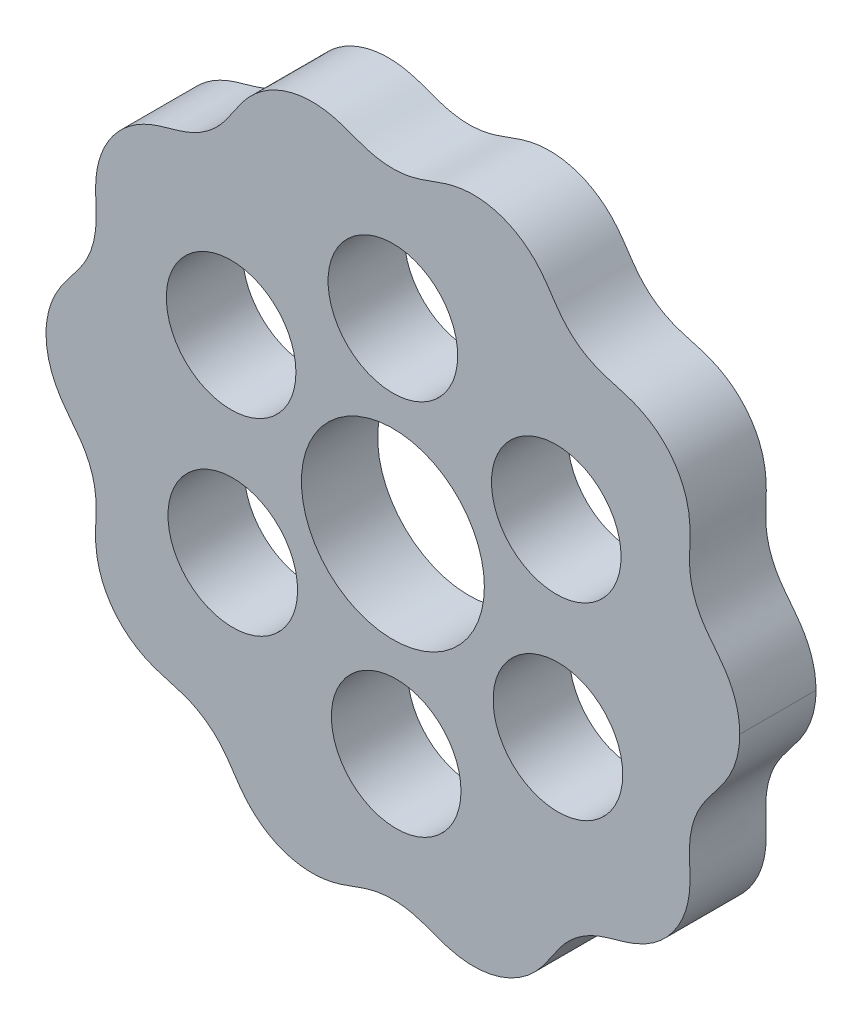
from build123d import *

# Parameters (mm, degrees)
BOSS_EXTRUDE1_DEPTH = 10
SKETCH2_R           = 12
SKETCH2_R_2         = 8.5
CUT_EXTRUDE2_DEPTH  = 10


with BuildPart() as part:
    # Sketch1 → Boss-Extrude1 (new body)
    with BuildSketch(Plane.XY):
        with BuildLine():
            add(Edge.make_bspline(
                [(-45.499991694, 0), (-45.499417721, 0.54652661), (-45.418630588, 1.636900829), (-45.062396728, 3.235524804), (-44.477595123, 4.770382806), (-43.802635021, 5.993801031), (-43.117584752, 6.994885069), (-42.499623664, 7.809687397), (-41.82997492, 8.642468091), (-41.110172207, 9.602905255), (-40.462520937, 10.575733976), (-39.757599748, 11.925585369), (-39.21583214, 13.555526257), (-38.972579651, 15.082244143), (-38.916270686, 16.281048526), (-38.927492874, 17.199543984), (-38.963794875, 18.175392663), (-39.003260031, 19.122059111), (-39.004031898, 20.081613072), (-38.955556207, 20.962340021), (-38.854082596, 21.801225418), (-38.645832299, 22.886789494), (-38.246727363, 24.191924223), (-37.547916858, 25.670868524), (-36.642286396, 27.033568382), (-35.549489209, 28.250867407), (-34.291990165, 29.297421962), (-33.12413689, 30.013667887), (-32.109992276, 30.49708058), (-31.297990382, 30.820605491), (-30.400687176, 31.118187135), (-29.3423349, 31.423004054), (-28.152021465, 31.747743147), (-26.759358853, 32.240343704), (-25.442641388, 32.853114744), (-24.023611732, 33.797227333), (-22.850981946, 34.90139513), (-22.045123753, 35.873232183), (-21.291150407, 36.920120743), (-20.680195351, 37.856732434), (-20.088480395, 38.718766678), (-19.531895352, 39.454370141), (-18.969636206, 40.109962603), (-18.383313671, 40.707421925), (-17.559784405, 41.436499391), (-16.447365301, 42.225420988), (-14.990552327, 42.969192488), (-13.440937058, 43.494661463), (-11.832306004, 43.790586252), (-10.196608172, 43.850838017), (-8.830558811, 43.704594158), (-7.718482479, 43.467180552), (-6.856019595, 43.224658939), (-5.915563706, 42.906355358), (-4.971111409, 42.550599633), (-3.942572046, 42.185362917), (-2.936548867, 41.874608525), (-1.591797743, 41.578785718), (0.084435721, 41.45309614), (1.737144316, 41.612285896), (3.031089125, 41.916499054), (4.006617187, 42.226326403), (4.999822604, 42.583557047), (5.935359682, 42.935639327), (6.864442923, 43.248322873), (7.725966983, 43.488123505), (8.834976574, 43.72134679), (10.201868138, 43.863159919), (11.836743584, 43.797264283), (13.444496644, 43.495872577), (14.992304531, 42.965093559), (16.446557836, 42.216346112), (17.556354774, 41.423607634), (18.378051445, 40.691263199), (18.963169579, 40.091199195), (19.525051949, 39.43217282), (20.083134983, 38.690896479), (20.680317711, 37.818928574), (21.305447581, 36.862747147), (22.091672553, 35.786924264), (22.937676069, 34.793085604), (24.154692188, 33.692110976), (25.584855424, 32.78536337), (26.868578459, 32.212851771), (28.220040833, 31.748210157), (29.383074268, 31.433257106), (30.426417711, 31.131917254), (31.317702477, 30.834269586), (32.126551087, 30.509259886), (33.13742679, 30.023499614), (34.302481893, 29.303589201), (35.556330934, 28.252795818), (36.644980393, 27.031780142), (37.545944658, 25.665902571), (38.239684637, 24.18498897), (38.713477442, 22.615295054), (38.92299222, 21.244126843), (38.984539855, 20.066104892), (38.981929249, 19.099312235), (38.941333185, 18.138789763), (38.906917281, 17.138757979), (38.90117585, 16.191197892), (38.9735828, 14.952525555), (39.25208527, 13.393388424), (39.829735801, 11.778030931), (40.534942522, 10.483089413), (41.17390481, 9.543590139), (41.874124828, 8.620016996), (42.53498679, 7.798492583), (43.144664402, 6.991997202), (43.823062809, 5.995531268), (44.494288144, 4.769310997), (45.073166177, 3.236688202), (45.336525158, 2.029885151), (45.437657193, 1.231257024), (45.474797823, 0.808305023), (45.491588116, 0.50246478), (45.498064717, 0.231736882), (45.499863392, 0.076479982), (45.49999849, 0.027806284), (45.499970481, 0)],
                knots=[0.499999152, 0.499999152, 0.499999152, 0.499999152, 0.506686373, 0.513341926, 0.519997479, 0.526653033, 0.529980809, 0.533308586, 0.536636363, 0.538300251, 0.539964139, 0.541628028, 0.543291916, 0.544955804, 0.546619693, 0.548283581, 0.549947469, 0.553275246, 0.556603023, 0.559930799, 0.563258576, 0.566586353, 0.573241906, 0.579897459, 0.586553013, 0.593208566, 0.599864119, 0.606519673, 0.609847449, 0.613175226, 0.616503003, 0.619830779, 0.623158556, 0.624822444, 0.626486333, 0.628150221, 0.629814109, 0.631477998, 0.633141886, 0.636469663, 0.639797439, 0.643125216, 0.646452993, 0.649780769, 0.653108546, 0.659764099, 0.666419653, 0.673075206, 0.679730759, 0.686386313, 0.693041866, 0.696369643, 0.699697419, 0.703025196, 0.706352973, 0.708016861, 0.709680749, 0.711344638, 0.713008526, 0.714672414, 0.716336303, 0.718000191, 0.719664079, 0.722991856, 0.726319633, 0.729647409, 0.732975186, 0.739630739, 0.746286293, 0.752941846, 0.759597399, 0.766252953, 0.772908506, 0.776236283, 0.779564059, 0.782891836, 0.786219613, 0.789547389, 0.792875166, 0.794539054, 0.796202943, 0.797866831, 0.799530719, 0.801194608, 0.802858496, 0.806186273, 0.809514049, 0.812841826, 0.816169603, 0.819497379, 0.826152933, 0.832808486, 0.839464039, 0.846119593, 0.852775146, 0.859430699, 0.866086253, 0.869414029, 0.872741806, 0.876069583, 0.877733471, 0.879397359, 0.881061248, 0.882725136, 0.884389024, 0.886052913, 0.887716801, 0.889380689, 0.892708466, 0.896036243, 0.899364019, 0.906019573, 0.912675126, 0.919330679, 0.920994568, 0.922658456, 0.924322344, 0.925154289, 0.925570261, 0.92598408, 0.92598408, 0.92598408, 0.92598408], degree=3))
            add(Edge.make_bspline(
                [(-45.499991694, 0), (-45.499417721, -0.54652661), (-45.418630588, -1.636900829), (-45.062396728, -3.235524804), (-44.477595123, -4.770382806), (-43.802635021, -5.993801031), (-43.117584752, -6.994885069), (-42.499623664, -7.809687397), (-41.82997492, -8.642468091), (-41.110172207, -9.602905255), (-40.462520937, -10.575733976), (-39.757599748, -11.925585369), (-39.21583214, -13.555526257), (-38.972579651, -15.082244143), (-38.916270686, -16.281048526), (-38.927492874, -17.199543984), (-38.963794875, -18.175392663), (-39.003260031, -19.122059111), (-39.004031898, -20.081613072), (-38.955556207, -20.962340021), (-38.854082596, -21.801225418), (-38.645832299, -22.886789494), (-38.246727363, -24.191924223), (-37.547916858, -25.670868524), (-36.642286396, -27.033568382), (-35.549489209, -28.250867407), (-34.291990165, -29.297421962), (-33.12413689, -30.013667887), (-32.109992276, -30.49708058), (-31.297990382, -30.820605491), (-30.400687176, -31.118187135), (-29.3423349, -31.423004054), (-28.152021465, -31.747743147), (-26.759358853, -32.240343704), (-25.442641388, -32.853114744), (-24.023611732, -33.797227333), (-22.850981946, -34.90139513), (-22.045123753, -35.873232183), (-21.291150407, -36.920120743), (-20.680195351, -37.856732434), (-20.088480395, -38.718766678), (-19.531895352, -39.454370141), (-18.969636206, -40.109962603), (-18.383313671, -40.707421925), (-17.559784405, -41.436499391), (-16.447365301, -42.225420988), (-14.990552327, -42.969192488), (-13.440937058, -43.494661463), (-11.832306004, -43.790586252), (-10.196608172, -43.850838017), (-8.830558811, -43.704594158), (-7.718482479, -43.467180552), (-6.856019595, -43.224658939), (-5.915563706, -42.906355358), (-4.971111409, -42.550599633), (-3.942572046, -42.185362917), (-2.936548867, -41.874608525), (-1.591797743, -41.578785718), (0.084435721, -41.45309614), (1.737144316, -41.612285896), (3.031089125, -41.916499054), (4.006617187, -42.226326403), (4.999822604, -42.583557047), (5.935359682, -42.935639327), (6.864442923, -43.248322873), (7.725966983, -43.488123505), (8.834976574, -43.72134679), (10.201868138, -43.863159919), (11.836743584, -43.797264283), (13.444496644, -43.495872577), (14.992304531, -42.965093559), (16.446557836, -42.216346112), (17.556354774, -41.423607634), (18.378051445, -40.691263199), (18.963169579, -40.091199195), (19.525051949, -39.43217282), (20.083134983, -38.690896479), (20.680317711, -37.818928574), (21.305447581, -36.862747147), (22.091672553, -35.786924264), (22.937676069, -34.793085604), (24.154692188, -33.692110976), (25.584855424, -32.78536337), (26.868578459, -32.212851771), (28.220040833, -31.748210157), (29.383074268, -31.433257106), (30.426417711, -31.131917254), (31.317702477, -30.834269586), (32.126551087, -30.509259886), (33.13742679, -30.023499614), (34.302481893, -29.303589201), (35.556330934, -28.252795818), (36.644980393, -27.031780142), (37.545944658, -25.665902571), (38.239684637, -24.18498897), (38.713477442, -22.615295054), (38.92299222, -21.244126843), (38.984539855, -20.066104892), (38.981929249, -19.099312235), (38.941333185, -18.138789763), (38.906917281, -17.138757979), (38.90117585, -16.191197892), (38.9735828, -14.952525555), (39.25208527, -13.393388424), (39.829735801, -11.778030931), (40.534942522, -10.483089413), (41.17390481, -9.543590139), (41.874124828, -8.620016996), (42.53498679, -7.798492583), (43.144664402, -6.991997202), (43.823062809, -5.995531268), (44.494288144, -4.769310997), (45.073166177, -3.236688202), (45.336525158, -2.029885151), (45.437657193, -1.231257024), (45.474797823, -0.808305023), (45.491588116, -0.50246478), (45.498064717, -0.231736882), (45.499863392, -0.076479982), (45.49999849, -0.027806284), (45.499970481, 0)],
                knots=[0.499999152, 0.499999152, 0.499999152, 0.499999152, 0.506686373, 0.513341926, 0.519997479, 0.526653033, 0.529980809, 0.533308586, 0.536636363, 0.538300251, 0.539964139, 0.541628028, 0.543291916, 0.544955804, 0.546619693, 0.548283581, 0.549947469, 0.553275246, 0.556603023, 0.559930799, 0.563258576, 0.566586353, 0.573241906, 0.579897459, 0.586553013, 0.593208566, 0.599864119, 0.606519673, 0.609847449, 0.613175226, 0.616503003, 0.619830779, 0.623158556, 0.624822444, 0.626486333, 0.628150221, 0.629814109, 0.631477998, 0.633141886, 0.636469663, 0.639797439, 0.643125216, 0.646452993, 0.649780769, 0.653108546, 0.659764099, 0.666419653, 0.673075206, 0.679730759, 0.686386313, 0.693041866, 0.696369643, 0.699697419, 0.703025196, 0.706352973, 0.708016861, 0.709680749, 0.711344638, 0.713008526, 0.714672414, 0.716336303, 0.718000191, 0.719664079, 0.722991856, 0.726319633, 0.729647409, 0.732975186, 0.739630739, 0.746286293, 0.752941846, 0.759597399, 0.766252953, 0.772908506, 0.776236283, 0.779564059, 0.782891836, 0.786219613, 0.789547389, 0.792875166, 0.794539054, 0.796202943, 0.797866831, 0.799530719, 0.801194608, 0.802858496, 0.806186273, 0.809514049, 0.812841826, 0.816169603, 0.819497379, 0.826152933, 0.832808486, 0.839464039, 0.846119593, 0.852775146, 0.859430699, 0.866086253, 0.869414029, 0.872741806, 0.876069583, 0.877733471, 0.879397359, 0.881061248, 0.882725136, 0.884389024, 0.886052913, 0.887716801, 0.889380689, 0.892708466, 0.896036243, 0.899364019, 0.906019573, 0.912675126, 0.919330679, 0.920994568, 0.922658456, 0.924322344, 0.925154289, 0.925570261, 0.92598408, 0.92598408, 0.92598408, 0.92598408], degree=3))
        make_face()
    extrude(amount=BOSS_EXTRUDE1_DEPTH)

    # Sketch2 → Cut-Extrude2 (cut)
    with BuildSketch(Plane.XY.offset(10)):
        Circle(SKETCH2_R)
        with Locations((0, 24.5)):
            Circle(SKETCH2_R_2)
        with Locations((21.434128744, 12.375)):
            Circle(SKETCH2_R_2)
        with Locations((21.650635095, -12.25)):
            Circle(SKETCH2_R_2)
        with Locations((0.433012702, -24.75)):
            Circle(SKETCH2_R_2)
        with Locations((-21.001116042, -12.625)):
            Circle(SKETCH2_R_2)
        with Locations((-21.217622393, 12)):
            Circle(SKETCH2_R_2)
    extrude(amount=-CUT_EXTRUDE2_DEPTH, mode=Mode.SUBTRACT)


solid = part.part
